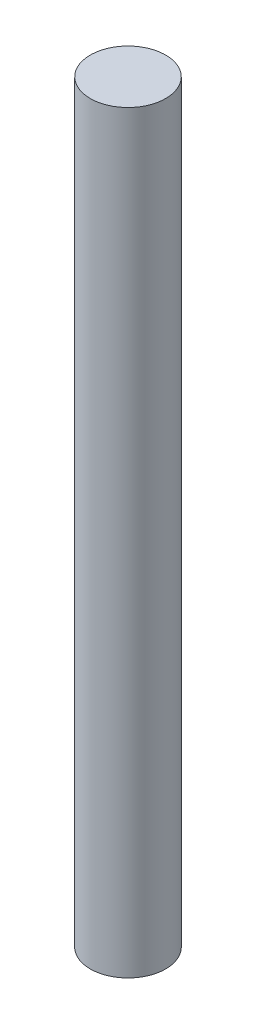
from build123d import *

# Parameters (mm, degrees)
CROQUIS1_R              = 0.5
SALIENTE_EXTRUIR1_DEPTH = 10


with BuildPart() as part:
    # Croquis1 → Saliente-Extruir1 (new body)
    with BuildSketch(Plane(origin=(0, 0, 0), x_dir=(1, 0, 0), z_dir=(0, 1, 0))):
        with Locations(Location((0, 0, 0), (0, 0, 270))):
            Circle(CROQUIS1_R)
    extrude(amount=SALIENTE_EXTRUIR1_DEPTH)


solid = part.part
